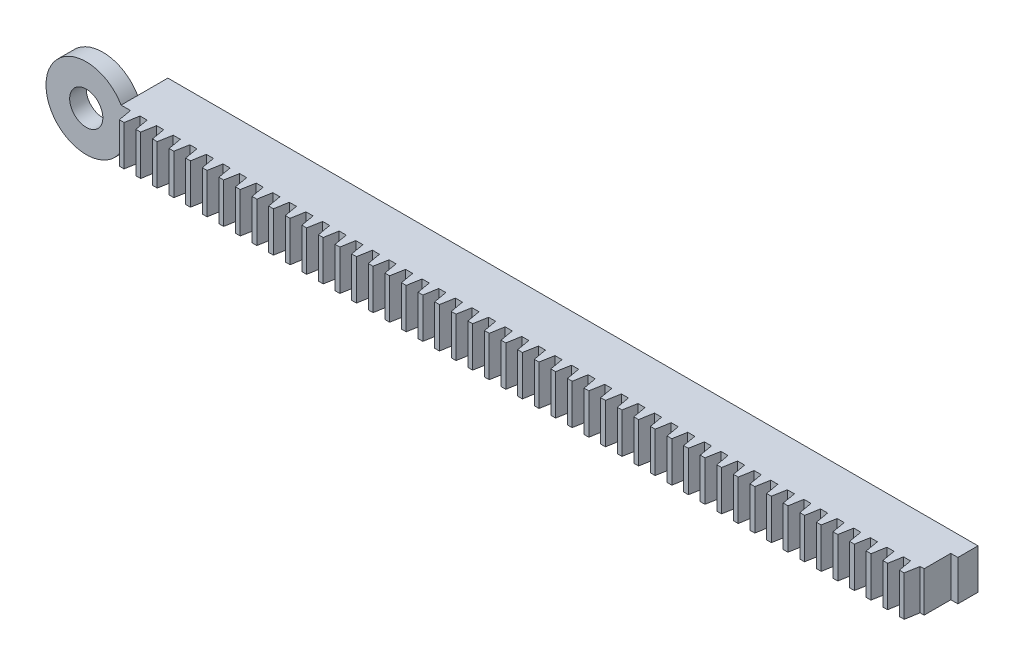
from build123d import *

# Parameters (mm, degrees)
SKETCH1_W               = 80
SKETCH1_H               = 4
BOSS_EXTRUDE1_DEPTH     = 2
BOSS_EXTRUDE2_DEPTH     = 4
LPATTERN1_COUNT         = 48
LPATTERN1_PITCH         = 1.65
SKETCH5_R               = 1.65
BOSS_EXTRUDE3_DEPTH     = 4.65
CUT_EXTRUDE1_DEPTH      = 69.784209361
CUT_EXTRUDE1_DEPTH_BACK = 69.784209361
SKETCH6_W               = 7.464101616
SKETCH6_H               = 3


with BuildPart() as part:
    # Sketch1 → Boss-Extrude1 (new body)
    with BuildSketch(Plane.XY):
        with Locations((28.258826956, 1.008805964)):
            Rectangle(SKETCH1_W, SKETCH1_H)
    extrude(amount=BOSS_EXTRUDE1_DEPTH)

    # Sketch4 → Boss-Extrude2 (add)
    with BuildSketch(Plane(origin=(0, 3.008805964, 0), x_dir=(1, 0, 0), z_dir=(0, 1, 0))):
        Polygon((-11.341173044, -4.65), (-11.10313162, -6), (-10.63313162, -6), (-10.395090196, -4.65), (-9.995090196, -4.65), (-9.995090196, 0), (-11.741173044, 0), (-11.741173044, -4.65), align=None)
    boss_extrude2 = extrude(amount=-BOSS_EXTRUDE2_DEPTH)

    # LPattern1: Boss-Extrude2 ×48
    with Locations(*[(i * LPATTERN1_PITCH, 0, 0) for i in range(1, LPATTERN1_COUNT)]):
        add(boss_extrude2)

    # Sketch5 → Boss-Extrude3 (add)
    with BuildSketch(Plane.XY):
        with BuildLine():
            Line((-11.741173044, 3.008805964), (-12.277071428, 3.008805964))
            ThreePointArc((-12.277071428, 3.008805964), (-19.741173044, 1.008805964), (-12.277071428, -0.991194036))
            Line((-12.277071428, -0.991194036), (-11.741173044, -0.991194036))
            Line((-11.741173044, -0.991194036), (-11.741173044, 3.008805964))
        make_face()
        with Locations((-15.741173044, 1.008805964)):
            Circle(SKETCH5_R, mode=Mode.SUBTRACT)
    extrude(amount=BOSS_EXTRUDE3_DEPTH)

    # Sketch6 → Cut-Extrude1 (cut, two sides: drawn at the far end of the back side and taken through both)
    with BuildSketch(Plane(origin=(0, 3.008805964, 0), x_dir=(1, 0, 0), z_dir=(0, 1, 0)).offset(-CUT_EXTRUDE1_DEPTH_BACK)):
        with Locations((-16.009122236, -1.5)):
            Rectangle(SKETCH6_W, SKETCH6_H)
    extrude(amount=CUT_EXTRUDE1_DEPTH + CUT_EXTRUDE1_DEPTH_BACK, mode=Mode.SUBTRACT)


solid = part.part
